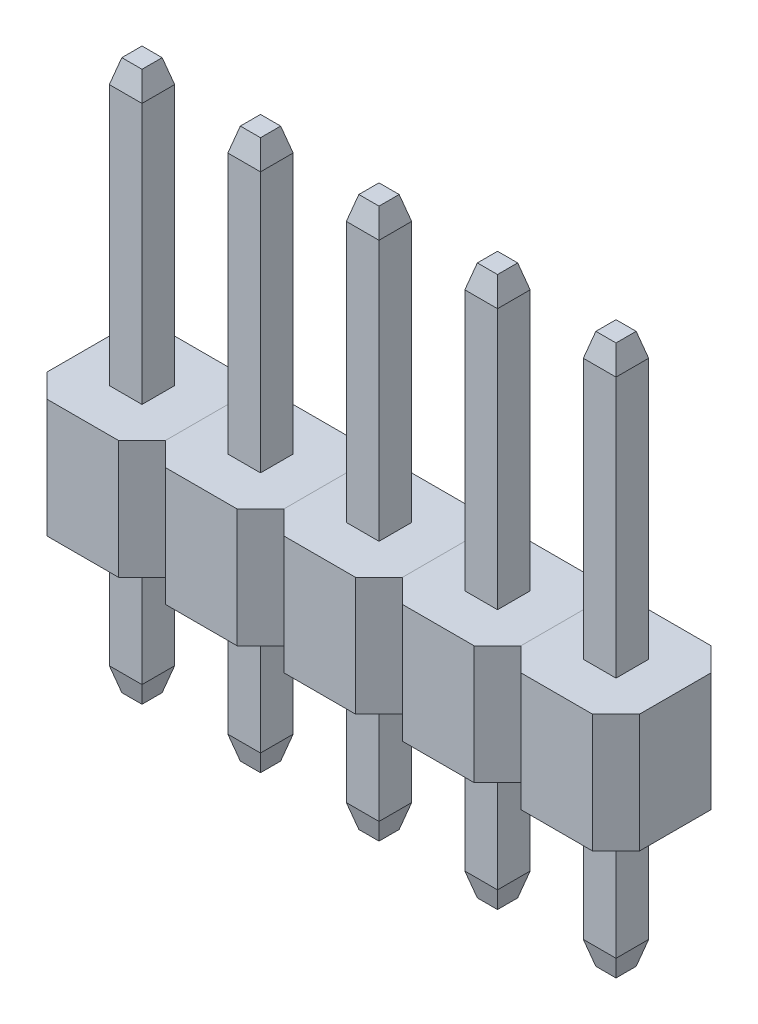
from build123d import *

# Parameters (mm, degrees)
SKETCH3_W           = 2.54
SKETCH3_H           = 2.54
SKETCH3_W_2         = 0.635
SKETCH3_H_2         = 0.635
BOSS_EXTRUDE1_DEPTH = 1.27
CHAMFER1_SIZE       = 0.5
BOSS_EXTRUDE2_START = -5.2
SKETCH5_W           = 0.7
SKETCH5_H           = 0.7
BOSS_EXTRUDE2_DEPTH = 10.788
SKETCH6_W           = 0.7
SKETCH6_H           = 0.7
BOSS_EXTRUDE3_DEPTH = 0.5
BOSS_EXTRUDE3_TAPER = 15
SKETCH7_W           = 0.7
SKETCH7_H           = 0.7
BOSS_EXTRUDE4_DEPTH = 0.5
BOSS_EXTRUDE4_TAPER = 15
LPATTERN1_COUNT     = 5
LPATTERN1_PITCH     = 2.54


with BuildPart() as part:
    # Sketch3 → Boss-Extrude1 (new, symmetric)
    with BuildSketch(Plane(origin=(0, 0, 0), x_dir=(1, 0, 0), z_dir=(0, 1, 0))):
        Rectangle(SKETCH3_W, SKETCH3_H)
        Rectangle(SKETCH3_W_2, SKETCH3_H_2, mode=Mode.SUBTRACT)
    extrude(amount=BOSS_EXTRUDE1_DEPTH, both=True)

    # Chamfer1
    chamfer1_edges = [part.edges().sort_by_distance(p)[0] for p in [
        (1.27, 0, 1.27),
        (-1.27, 0, 1.27),
        (-1.27, 0, -1.27),
        (1.27, 0, -1.27),
    ]]
    chamfer(chamfer1_edges, length=CHAMFER1_SIZE)


with BuildPart() as body_2:
    # Sketch5 → Boss-Extrude2 (new body)
    with BuildSketch(Plane(origin=(0, 1.27, 0), x_dir=(1, 0, 0), z_dir=(0, 1, 0)).offset(BOSS_EXTRUDE2_START)):
        Rectangle(SKETCH5_W, SKETCH5_H)
    extrude(amount=BOSS_EXTRUDE2_DEPTH)

    # Sketch6 → Boss-Extrude3 (add)
    with BuildSketch(Plane(origin=(0, 6.858, 0), x_dir=(1, 0, 0), z_dir=(0, 1, 0))):
        Rectangle(SKETCH6_W, SKETCH6_H)
    extrude(amount=BOSS_EXTRUDE3_DEPTH, taper=BOSS_EXTRUDE3_TAPER)

    # Sketch7 → Boss-Extrude4 (add)
    with BuildSketch(Plane.XZ.offset(3.93)):
        Rectangle(SKETCH7_W, SKETCH7_H)
    extrude(amount=BOSS_EXTRUDE4_DEPTH, taper=BOSS_EXTRUDE4_TAPER)


with BuildPart() as lpattern1_1:
    # LPattern1: pattern copy
    add(body_2.part.moved(Location(Vector(1, 0, 0) * (1 * LPATTERN1_PITCH))))


with BuildPart() as lpattern1_2:
    # LPattern1: pattern copy
    add(body_2.part.moved(Location(Vector(1, 0, 0) * (2 * LPATTERN1_PITCH))))


with BuildPart() as lpattern1_3:
    # LPattern1: pattern copy
    add(body_2.part.moved(Location(Vector(1, 0, 0) * (3 * LPATTERN1_PITCH))))


with BuildPart() as lpattern1_4:
    # LPattern1: pattern copy
    add(body_2.part.moved(Location(Vector(1, 0, 0) * (4 * LPATTERN1_PITCH))))


with BuildPart() as lpattern1_5:
    # LPattern1: pattern copy
    add(part.part.moved(Location(Vector(1, 0, 0) * (1 * LPATTERN1_PITCH))))


with BuildPart() as lpattern1_6:
    # LPattern1: pattern copy
    add(part.part.moved(Location(Vector(1, 0, 0) * (2 * LPATTERN1_PITCH))))


with BuildPart() as lpattern1_7:
    # LPattern1: pattern copy
    add(part.part.moved(Location(Vector(1, 0, 0) * (3 * LPATTERN1_PITCH))))


with BuildPart() as lpattern1_8:
    # LPattern1: pattern copy
    add(part.part.moved(Location(Vector(1, 0, 0) * (4 * LPATTERN1_PITCH))))


solid = Compound([part.part, body_2.part, lpattern1_1.part, lpattern1_2.part, lpattern1_3.part, lpattern1_4.part, lpattern1_5.part, lpattern1_6.part, lpattern1_7.part, lpattern1_8.part])
